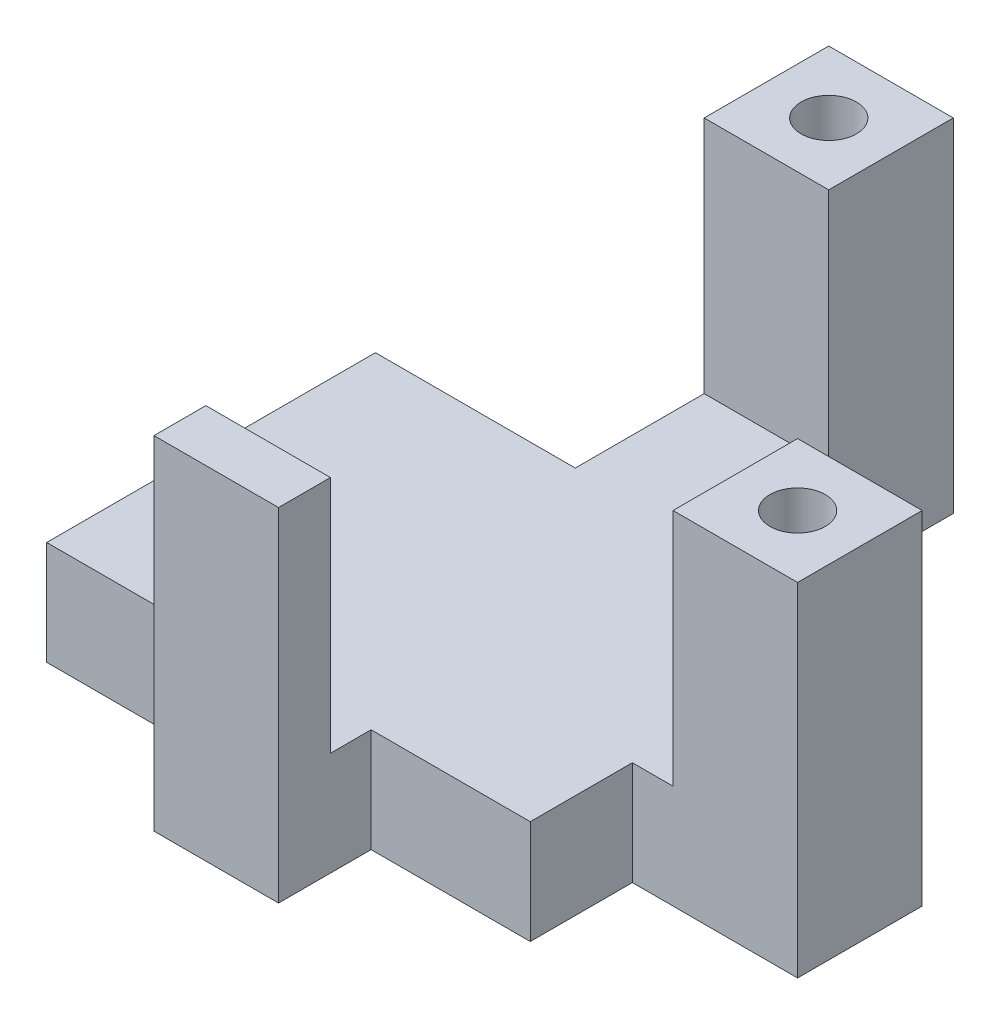
from build123d import *

# Parameters (mm, degrees)
SKETCH1_W            = 68.05
SKETCH1_H            = 3
BOSS_EXTRUDE1_DEPTH  = 3
SKETCH5_W            = 3
SKETCH5_H            = 3
BOSS_EXTRUDE2_DEPTH  = 16.8
SKETCH6_W            = 3
SKETCH6_H            = 3
BOSS_EXTRUDE3_DEPTH  = 30.3
BOSS_EXTRUDE4_DEPTH  = 16
SKETCH10_W           = 33.3
SKETCH10_H           = 19
BOSS_EXTRUDE5_DEPTH  = 3
BOSS_EXTRUDE6_DEPTH  = 3.05
SKETCH13_R           = 2.85
CUT_EXTRUDE1_DEPTH   = 21.5
SKETCH14_W           = 3
SKETCH14_H           = 6.05
SKETCH14_H_2         = 6
BOSS_EXTRUDE7_DEPTH  = 10.45
SKETCH15_W           = 3
SKETCH15_H           = 3
BOSS_EXTRUDE8_DEPTH  = 13.8
SKETCH16_W           = 3
SKETCH16_H           = 6.05
SKETCH16_H_2         = 6
BOSS_EXTRUDE9_DEPTH  = 5.35
SKETCH17_W           = 3
SKETCH17_H           = 3
BOSS_EXTRUDE10_DEPTH = 13.8
SKETCH20_W           = 8.95
SKETCH20_H           = 6
BOSS_EXTRUDE12_DEPTH = 19.6
SKETCH22_R           = 2.85
CUT_EXTRUDE3_DEPTH   = 93.157514615
SKETCH23_W           = 3
SKETCH23_H           = 6.05
CUT_EXTRUDE4_DEPTH   = 34.75
SKETCH24_W           = 8.95
SKETCH24_H           = 6
CUT_EXTRUDE5_DEPTH   = 19.6
SKETCH25_W           = 33.3
SKETCH25_H           = 19
CUT_EXTRUDE7_DEPTH   = 6.05
SKETCH27_W           = 3
SKETCH27_H           = 10.45
SKETCH27_H_2         = 5.35
CUT_EXTRUDE8_DEPTH   = 25.85
SKETCH28_W           = 3
SKETCH28_H           = 13.8
CUT_EXTRUDE9_DEPTH   = 19
SKETCH29_W           = 3
SKETCH29_H           = 10.45
SKETCH29_H_2         = 5.35
CUT_EXTRUDE10_DEPTH  = 6.05
BOSS_EXTRUDE13_DEPTH = 2.1
BOSS_EXTRUDE14_DEPTH = 2.1
SKETCH32_W           = 7.2
SKETCH32_H           = 19.8
BOSS_EXTRUDE15_DEPTH = 4.2
SKETCH33_R           = 1.6
CUT_EXTRUDE11_DEPTH  = 75.938408043
SKETCH34_W           = 19
SKETCH34_H           = 6
CUT_EXTRUDE12_DEPTH  = 5.35
SKETCH36_W           = 7.2
SKETCH36_H           = 6
BOSS_EXTRUDE16_DEPTH = 9.55
SKETCH37_W           = 7.2
SKETCH37_H           = 7.2
BOSS_EXTRUDE17_DEPTH = 13.8
SKETCH39_R           = 1.6
CUT_EXTRUDE13_DEPTH  = 19.8


with BuildPart() as part:
    # Sketch1 → Boss-Extrude1 (new body)
    with BuildSketch(Plane.XY):
        with Locations((34.025, -1.5)):
            Rectangle(SKETCH1_W, SKETCH1_H)
    extrude(amount=BOSS_EXTRUDE1_DEPTH)

    # Sketch5 → Boss-Extrude2 (add)
    with BuildSketch(Plane.XZ.offset(3)):
        with Locations((66.55, 1.5)):
            Rectangle(SKETCH5_W, SKETCH5_H)
    extrude(amount=BOSS_EXTRUDE2_DEPTH)

    # Sketch6 → Boss-Extrude3 (add)
    with BuildSketch(Plane.ZY.offset(-65.05)):
        with Locations((1.5, -18.3)):
            Rectangle(SKETCH6_W, SKETCH6_H)
    extrude(amount=BOSS_EXTRUDE3_DEPTH)

    # Sketch8 → Boss-Extrude4 (add)
    with BuildSketch(Plane.XY.offset(3)):
        Polygon((34.75, -3), (34.75, 0), (68.05, 0), (68.05, -19.8), (34.75, -19.8), (34.75, -16.8), (65.05, -16.8), (65.05, -3), align=None)
    extrude(amount=BOSS_EXTRUDE4_DEPTH)

    # Sketch10 → Boss-Extrude5 (add)
    with BuildSketch(Plane.XZ.offset(19.8)):
        with Locations((51.4, 9.5)):
            Rectangle(SKETCH10_W, SKETCH10_H)
    extrude(amount=BOSS_EXTRUDE5_DEPTH)

    # Sketch12 → Boss-Extrude6 (add)
    with BuildSketch(Plane(origin=(0, 0, 0), x_dir=(1, 0, 0), z_dir=(0, 1, 0))):
        Polygon((0, 0), (0, -3), (34.75, -3), (34.75, -19), (68.05, -19), (68.05, 0), align=None)
    extrude(amount=BOSS_EXTRUDE6_DEPTH)

    # Sketch13 → Cut-Extrude1 (cut)
    with BuildSketch(Plane(origin=(0, 0, 0), x_dir=(-1, 0, 0), z_dir=(0, 0, -1))):
        with Locations((-4.875, -0.8)):
            Circle(SKETCH13_R)
    extrude(amount=-CUT_EXTRUDE1_DEPTH, mode=Mode.SUBTRACT)

    # Sketch14 → Boss-Extrude7 (add)
    with BuildSketch(Plane(origin=(0, 0, 0), x_dir=(-1, 0, 0), z_dir=(0, 0, -1))):
        with Locations((-60.55, 0.025)):
            Rectangle(SKETCH14_W, SKETCH14_H)
        with Locations((-39.25, 0.025)):
            Rectangle(SKETCH14_W, SKETCH14_H)
        with Locations((-49.9, 0.025)):
            Rectangle(SKETCH14_W, SKETCH14_H)
        with Locations((-60.55, -19.8)):
            Rectangle(SKETCH14_W, SKETCH14_H_2)
        with Locations((-49.9, -19.8)):
            Rectangle(SKETCH14_W, SKETCH14_H_2)
        with Locations((-39.25, -19.8)):
            Rectangle(SKETCH14_W, SKETCH14_H_2)
    extrude(amount=BOSS_EXTRUDE7_DEPTH)

    # Sketch15 → Boss-Extrude8 (add)
    with BuildSketch(Plane(origin=(0, -16.8, 0), x_dir=(1, 0, 0), z_dir=(0, 1, 0))):
        with Locations((60.55, 8.95)):
            Rectangle(SKETCH15_W, SKETCH15_H)
        with Locations((49.9, 8.95)):
            Rectangle(SKETCH15_W, SKETCH15_H)
        with Locations((39.25, 8.95)):
            Rectangle(SKETCH15_W, SKETCH15_H)
    extrude(amount=BOSS_EXTRUDE8_DEPTH)

    # Sketch16 → Boss-Extrude9 (add)
    with BuildSketch(Plane.XY.offset(19)):
        with Locations((39.25, 0.025)):
            Rectangle(SKETCH16_W, SKETCH16_H)
        with Locations((49.9, 0.025)):
            Rectangle(SKETCH16_W, SKETCH16_H)
        with Locations((60.55, 0.025)):
            Rectangle(SKETCH16_W, SKETCH16_H)
        with Locations((39.25, -19.8)):
            Rectangle(SKETCH16_W, SKETCH16_H_2)
        with Locations((49.9, -19.8)):
            Rectangle(SKETCH16_W, SKETCH16_H_2)
        with Locations((60.55, -19.8)):
            Rectangle(SKETCH16_W, SKETCH16_H_2)
    extrude(amount=BOSS_EXTRUDE9_DEPTH)

    # Sketch17 → Boss-Extrude10 (add)
    with BuildSketch(Plane(origin=(0, -16.8, 0), x_dir=(1, 0, 0), z_dir=(0, 1, 0))):
        with Locations((39.25, -22.85)):
            Rectangle(SKETCH17_W, SKETCH17_H)
        with Locations((49.9, -22.85)):
            Rectangle(SKETCH17_W, SKETCH17_H)
        with Locations((60.55, -22.85)):
            Rectangle(SKETCH17_W, SKETCH17_H)
    extrude(amount=BOSS_EXTRUDE10_DEPTH)

    # Sketch20 → Boss-Extrude12 (add)
    with BuildSketch(Plane(origin=(68.05, 0, 0), x_dir=(0, 0, -1), z_dir=(1, 0, 0))):
        with Locations((-7.475, -14.7)):
            Rectangle(SKETCH20_W, SKETCH20_H)
    extrude(amount=BOSS_EXTRUDE12_DEPTH)

    # Sketch22 → Cut-Extrude3 (cut, through all)
    with BuildSketch(Plane(origin=(0, -11.7, 0), x_dir=(1, 0, 0), z_dir=(0, 1, 0))):
        with Locations(Location((83.8, -7.95, 0), (0, 0, 270))):
            Circle(SKETCH22_R)
    extrude(amount=-CUT_EXTRUDE3_DEPTH, mode=Mode.SUBTRACT)

    # Sketch23 → Cut-Extrude4 (cut)
    with BuildSketch(Plane.ZY):
        with Locations((1.5, 0.025)):
            Rectangle(SKETCH23_W, SKETCH23_H)
    extrude(amount=-CUT_EXTRUDE4_DEPTH, mode=Mode.SUBTRACT)

    # Sketch24 → Cut-Extrude5 (cut)
    with BuildSketch(Plane(origin=(87.65, 0, 0), x_dir=(0, 0, -1), z_dir=(1, 0, 0))):
        with Locations((-7.475, -14.7)):
            Rectangle(SKETCH24_W, SKETCH24_H)
    extrude(amount=-CUT_EXTRUDE5_DEPTH, mode=Mode.SUBTRACT)

    # Sketch25 → Cut-Extrude7 (cut)
    with BuildSketch(Plane(origin=(0, 3.05, 0), x_dir=(1, 0, 0), z_dir=(0, 1, 0))):
        with Locations((51.4, -9.5)):
            Rectangle(SKETCH25_W, SKETCH25_H)
    extrude(amount=-CUT_EXTRUDE7_DEPTH, mode=Mode.SUBTRACT)

    # Sketch27 → Cut-Extrude8 (cut)
    with BuildSketch(Plane(origin=(0, 3.05, 0), x_dir=(1, 0, 0), z_dir=(0, 1, 0))):
        with Locations((39.25, 5.225)):
            Rectangle(SKETCH27_W, SKETCH27_H)
        with Locations((39.25, -21.675)):
            Rectangle(SKETCH27_W, SKETCH27_H_2)
        with Locations((60.55, 5.225)):
            Rectangle(SKETCH27_W, SKETCH27_H)
        with Locations((60.55, -21.675)):
            Rectangle(SKETCH27_W, SKETCH27_H_2)
    extrude(amount=-CUT_EXTRUDE8_DEPTH, mode=Mode.SUBTRACT)

    # Sketch28 → Cut-Extrude9 (cut)
    with BuildSketch(Plane.XY.offset(19)):
        with Locations((66.55, -9.9)):
            Rectangle(SKETCH28_W, SKETCH28_H)
    extrude(amount=-CUT_EXTRUDE9_DEPTH, mode=Mode.SUBTRACT)

    # Sketch29 → Cut-Extrude10 (cut)
    with BuildSketch(Plane(origin=(0, 3.05, 0), x_dir=(1, 0, 0), z_dir=(0, 1, 0))):
        with Locations((49.9, 5.225)):
            Rectangle(SKETCH29_W, SKETCH29_H)
        with Locations((49.9, -21.675)):
            Rectangle(SKETCH29_W, SKETCH29_H_2)
    extrude(amount=-CUT_EXTRUDE10_DEPTH, mode=Mode.SUBTRACT)

    # Sketch30 → Boss-Extrude13 (add)
    with BuildSketch(Plane.ZY.offset(-48.4)):
        Polygon((-10.45, -3), (-10.45, -22.8), (0, -22.8), (0, -16.8), (-7.45, -16.8), (-7.45, -3), align=None)
        Polygon((21.35, -3), (21.35, -16.8), (19, -16.8), (19, -22.8), (24.35, -22.8), (24.35, -3), align=None)
    extrude(amount=BOSS_EXTRUDE13_DEPTH)

    # Sketch31 → Boss-Extrude14 (add)
    with BuildSketch(Plane(origin=(51.4, 0, 0), x_dir=(0, 0, -1), z_dir=(1, 0, 0))):
        Polygon((-24.35, -3), (-24.35, -22.8), (-19, -22.8), (-19, -16.8), (-21.35, -16.8), (-21.35, -3), align=None)
        Polygon((7.45, -3), (10.45, -3), (10.45, -22.8), (0, -22.8), (0, -16.8), (7.45, -16.8), align=None)
    extrude(amount=BOSS_EXTRUDE14_DEPTH)

    # Sketch32 → Boss-Extrude15 (add)
    with BuildSketch(Plane(origin=(0, 0, -10.45), x_dir=(-1, 0, 0), z_dir=(0, 0, -1))):
        with Locations((-49.9, -12.9)):
            Rectangle(SKETCH32_W, SKETCH32_H)
    extrude(amount=BOSS_EXTRUDE15_DEPTH)

    # Sketch33 → Cut-Extrude11 (cut, through all)
    with BuildSketch(Plane.XZ.offset(22.8)):
        with Locations((49.9, -11.05)):
            Circle(SKETCH33_R)
    extrude(amount=-CUT_EXTRUDE11_DEPTH, mode=Mode.SUBTRACT)

    # Sketch34 → Cut-Extrude12 (cut)
    with BuildSketch(Plane(origin=(68.05, 0, 0), x_dir=(0, 0, -1), z_dir=(1, 0, 0))):
        with Locations((-9.5, -19.8)):
            Rectangle(SKETCH34_W, SKETCH34_H)
    extrude(amount=-CUT_EXTRUDE12_DEPTH, mode=Mode.SUBTRACT)

    # Sketch36 → Boss-Extrude16 (add)
    with BuildSketch(Plane(origin=(62.7, 0, 0), x_dir=(0, 0, -1), z_dir=(1, 0, 0))):
        with Locations((-9.5, -19.8)):
            Rectangle(SKETCH36_W, SKETCH36_H)
    extrude(amount=BOSS_EXTRUDE16_DEPTH)

    # Sketch37 → Boss-Extrude17 (add)
    with BuildSketch(Plane(origin=(0, -16.8, 0), x_dir=(1, 0, 0), z_dir=(0, 1, 0))):
        with Locations((68.65, -9.5)):
            Rectangle(SKETCH37_W, SKETCH37_H)
    extrude(amount=BOSS_EXTRUDE17_DEPTH)

    # Sketch39 → Cut-Extrude13 (cut)
    with BuildSketch(Plane(origin=(0, -3, 0), x_dir=(1, 0, 0), z_dir=(0, 1, 0))):
        with Locations(Location((68.65, -9.5, 0), (0, 0, 270))):
            Circle(SKETCH39_R)
    extrude(amount=-CUT_EXTRUDE13_DEPTH, mode=Mode.SUBTRACT)


solid = part.part
